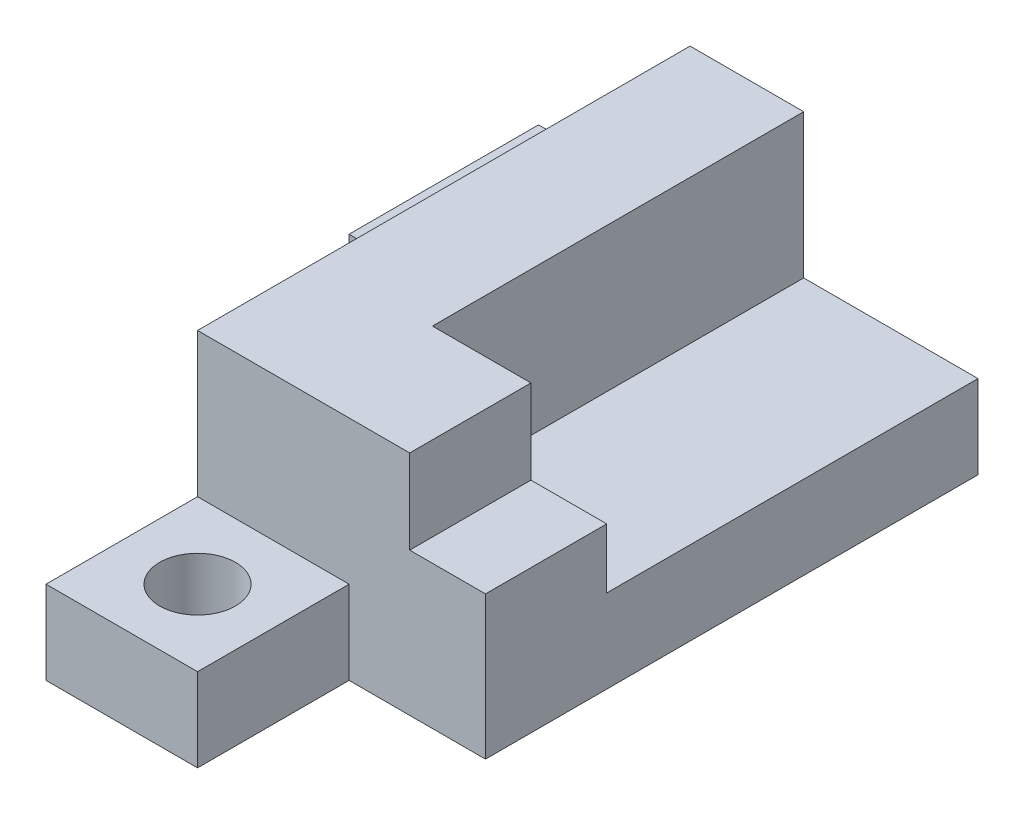
from build123d import *

# Parameters (mm, degrees)
SKETCH1_W                   = 369
SKETCH1_H                   = 200
BOSS_EXTRUDE1_DEPTH         = 20
SKETCH2_W                   = 129
SKETCH2_H                   = 16
BOSS_EXTRUDE2_DEPTH         = 10
SKETCH3_W                   = 342
SKETCH3_H                   = 168
CUT_EXTRUDE1_DEPTH          = 9
SKETCH4_W                   = 100
SKETCH4_H                   = 10
BOSS_EXTRUDE3_DEPTH         = 60
CUT_EXTRUDE3_DEPTH          = 10
CUT_EXTRUDE3_DEPTH_BACK     = 60
SKETCH10_W                  = 404
SKETCH10_H                  = 324.796202869
CUT_EXTRUDE4_DEPTH          = 69
CUT_EXTRUDE7_DEPTH          = 274.752168941
CUT_EXTRUDE7_DEPTH_BACK     = 274.752168941
SKETCH14_W                  = 37
SKETCH14_H                  = 34.717467541
SKETCH12_W                  = 50
SKETCH12_H                  = 11
BOSS_EXTRUDE6_DEPTH         = 20
SKETCH13_R                  = 4
CUT_EXTRUDE6_DEPTH          = 229.43215623
CORTAR_EXTRUIR4_DEPTH       = 220
CROQUIS5_W                  = 20
CROQUIS5_H                  = 11
SALIENTE_EXTRUIR2_DEPTH     = 10
CROQUIS6_W                  = 20
CROQUIS6_H                  = 11
SALIENTE_EXTRUIR3_DEPTH     = 20
CROQUIS8_R                  = 5
CORTAR_EXTRUIR5_DEPTH       = 48
CROQUIS9_W                  = 38
CROQUIS9_H                  = 65
CORTAR_EXTRUIR6_DEPTH       = 85
CROQUIS10_W                 = 10
CROQUIS10_H                 = 16
SALIENTE_EXTRUIR4_DEPTH     = 7.89
CROQUIS11_W                 = 16
CROQUIS11_H                 = 19
SALIENTE_EXTRUIR5_DEPTH     = 13
CORTAR_EXTRUIR10_DEPTH      = 36.9
CORTAR_EXTRUIR10_DEPTH_BACK = 7.894953
CROQUIS12_W                 = 18
CROQUIS12_H                 = 16
CROQUIS13_W                 = 5
CROQUIS13_H                 = 16
CORTAR_EXTRUIR11_DEPTH      = 19
CROQUIS14_W                 = 25
CROQUIS14_H                 = 11
SALIENTE_EXTRUIR6_DEPTH     = 20
CROQUIS15_W                 = 20
CROQUIS15_H                 = 25
CORTAR_EXTRUIR12_DEPTH      = 238.868135739
CROQUIS16_R                 = 5
CORTAR_EXTRUIR13_DEPTH      = 238.868135739
CROQUIS17_W                 = 20
CROQUIS17_H                 = 20
SALIENTE_EXTRUIR7_DEPTH     = 11
CROQUIS18_W                 = 20
CROQUIS18_H                 = 20
CORTAR_EXTRUIR14_DEPTH      = 238.868135739
CROQUIS19_R                 = 5
CORTAR_EXTRUIR15_DEPTH      = 229.43215623


with BuildPart() as part:
    # Sketch1 → Boss-Extrude1 (new body)
    with BuildSketch(Plane(origin=(0, 0, 0), x_dir=(1, 0, 0), z_dir=(0, 1, 0))):
        Rectangle(SKETCH1_W, SKETCH1_H)
    extrude(amount=BOSS_EXTRUDE1_DEPTH)

    # Sketch2 → Boss-Extrude2 (add)
    with BuildSketch(Plane(origin=(0, 20, 0), x_dir=(1, 0, 0), z_dir=(0, 1, 0))):
        Polygon((-184.5, -100), (-169.5, -100), (-119.5, -100), (-119.5, -84), (-169.5, -84), (-169.5, -35), (-184.5, -35), align=None)
        Polygon((-184.5, 100), (-169.5, 100), (-119.5, 100), (-119.5, 84), (-169.5, 84), (-169.5, 35), (-184.5, 35), align=None)
        with Locations((20, -92)):
            Rectangle(SKETCH2_W, SKETCH2_H)
        with Locations((20, 92)):
            Rectangle(SKETCH2_W, SKETCH2_H)
    extrude(amount=BOSS_EXTRUDE2_DEPTH)

    # Sketch3 → Cut-Extrude1 (cut)
    with BuildSketch(Plane(origin=(0, 20, 0), x_dir=(1, 0, 0), z_dir=(0, 1, 0))):
        with Locations((1.5, 0)):
            Rectangle(SKETCH3_W, SKETCH3_H)
    extrude(amount=-CUT_EXTRUDE1_DEPTH, mode=Mode.SUBTRACT)

    # Sketch4 → Boss-Extrude3 (add)
    with BuildSketch(Plane(origin=(0, 0, -100), x_dir=(-1, 0, 0), z_dir=(0, 0, -1))):
        with Locations((-19.5, 25)):
            Rectangle(SKETCH4_W, SKETCH4_H)
    extrude(amount=BOSS_EXTRUDE3_DEPTH)

    # Sketch6 → Cut-Extrude3 (cut, two sides: drawn at the far end of the back side and taken through both)
    with BuildSketch(Plane.XY.offset(-84).offset(-CUT_EXTRUDE3_DEPTH_BACK)):
        with BuildLine():
            Line((-24.5, 30), (-26.030765637, 28.081051534))
            ThreePointArc((-26.030765637, 28.081051534), (-26.158442873, 26.948989892), (-25.193843525, 26.342843758))
            Line((-25.193843525, 26.342843758), (-15.806155854, 26.342843758))
            ThreePointArc((-15.806155854, 26.342843758), (-14.841556992, 26.948990172), (-14.969234363, 28.081051534))
            Line((-14.969234363, 28.081051534), (-16.5, 30))
            Line((-16.5, 30), (-24.5, 30))
        make_face()
        with BuildLine():
            Line((56.5, 30), (54.981983491, 27.801494438))
            ThreePointArc((54.981983491, 27.801494438), (54.9192914, 26.767046688), (55.80615587, 26.230871478))
            Line((55.80615587, 26.230871478), (65.193843541, 26.230871478))
            ThreePointArc((65.193843541, 26.230871478), (66.080708464, 26.767046428), (66.018016509, 27.801494438))
            Line((66.018016509, 27.801494438), (64.5, 30))
            Line((64.5, 30), (56.5, 30))
        make_face()
    extrude(amount=CUT_EXTRUDE3_DEPTH + CUT_EXTRUDE3_DEPTH_BACK, mode=Mode.SUBTRACT)

    # Sketch10 → Cut-Extrude4 (cut)
    with BuildSketch(Plane(origin=(0, 30, 0), x_dir=(1, 0, 0), z_dir=(0, 1, 0))):
        with Locations((55.5, -0.89352463)):
            Rectangle(SKETCH10_W, SKETCH10_H)
    extrude(amount=-CUT_EXTRUDE4_DEPTH, mode=Mode.SUBTRACT)

    # Sketch14 → Cut-Extrude7 (cut, two sides: drawn at the far end of the back side and taken through both)
    with BuildSketch(Plane(origin=(0, 0, -100), x_dir=(-1, 0, 0), z_dir=(0, 0, -1)).offset(-CUT_EXTRUDE7_DEPTH_BACK)):
        with Locations((138, 36.253686327)):
            Rectangle(SKETCH14_W, SKETCH14_H)
    extrude(amount=CUT_EXTRUDE7_DEPTH + CUT_EXTRUDE7_DEPTH_BACK, mode=Mode.SUBTRACT)

    # Sketch12 → Boss-Extrude6 (add)
    with BuildSketch(Plane.ZY.offset(184.5)):
        with Locations((-25, 5.5)):
            Rectangle(SKETCH12_W, SKETCH12_H)
    extrude(amount=BOSS_EXTRUDE6_DEPTH)

    # Sketch13 → Cut-Extrude6 (cut, through all)
    with BuildSketch(Plane(origin=(0, 11, 0), x_dir=(1, 0, 0), z_dir=(0, 1, 0))):
        with Locations(Location((-194.5, 25, 0), (0, 0, 270))):
            Circle(SKETCH13_R)
    extrude(amount=-CUT_EXTRUDE6_DEPTH, mode=Mode.SUBTRACT)

    # Croquis3 → Cortar-Extruir4 (cut)
    with BuildSketch(Plane(origin=(0, 30, 0), x_dir=(1, 0, 0), z_dir=(0, 1, 0))):
        Polygon((-169.5, -35), (-146.5, -35), (-146.5, 0), (-146.5, 35), (-204.5, 35), (-204.5, 0), (-204.5, -35), (-184.5, -35), align=None)
    extrude(amount=-CORTAR_EXTRUIR4_DEPTH, mode=Mode.SUBTRACT)


with BuildPart() as cortar_extruir4_piece_1:
    # of the separate pieces the step leaves, piece 1, a body of its own (cortar_extruir4_pieces)
    add(part.part.solids().sort_by_distance((-184.5, 30, -100))[0])

    # Croquis5 → Saliente-Extruir2 (add)
    with BuildSketch(Plane(origin=(0, 0, -50), x_dir=(-1, 0, 0), z_dir=(0, 0, -1))):
        with Locations((194.5, 5.5)):
            Rectangle(CROQUIS5_W, CROQUIS5_H)
    extrude(amount=SALIENTE_EXTRUIR2_DEPTH)

    # Croquis6 → Saliente-Extruir3 (add)
    with BuildSketch(Plane(origin=(0, 0, -100), x_dir=(-1, 0, 0), z_dir=(0, 0, -1))):
        with Locations((174.5, 5.5)):
            Rectangle(CROQUIS6_W, CROQUIS6_H)
    extrude(amount=SALIENTE_EXTRUIR3_DEPTH)

    # Croquis8 → Cortar-Extruir5 (cut)
    with BuildSketch(Plane(origin=(0, 11, 0), x_dir=(1, 0, 0), z_dir=(0, 1, 0))):
        with Locations(Location((-194.5, 47.5, 0), (0, 0, 270))):
            Circle(CROQUIS8_R)
        with Locations((-194.5, -47.5)):
            Circle(CROQUIS8_R)
        with Locations((-174.5, -110)):
            Circle(CROQUIS8_R)
        with Locations(Location((-174.5, 110, 0), (0, 0, 270))):
            Circle(CROQUIS8_R)
    extrude(amount=-CORTAR_EXTRUIR5_DEPTH, mode=Mode.SUBTRACT)

    # Croquis10 → Saliente-Extruir4 (add)
    with BuildSketch(Plane(origin=(0, 11, 0), x_dir=(1, 0, 0), z_dir=(0, 1, 0))):
        with Locations((-151.5, 43)):
            Rectangle(CROQUIS10_W, CROQUIS10_H)
    extrude(amount=SALIENTE_EXTRUIR4_DEPTH)

    # Croquis11 → Saliente-Extruir5 (add)
    with BuildSketch(Plane(origin=(-169.5, 0, 0), x_dir=(0, 0, -1), z_dir=(1, 0, 0))):
        with Locations((43, 20.5)):
            Rectangle(CROQUIS11_W, CROQUIS11_H)
    extrude(amount=SALIENTE_EXTRUIR5_DEPTH)

    # Croquis12 → Cortar-Extruir10 (cut, two sides: drawn at the far end of the back side and taken through both)
    with BuildSketch(Plane(origin=(0, 18.894952557, 0), x_dir=(1, 0, 0), z_dir=(0, 1, 0)).offset(-CORTAR_EXTRUIR10_DEPTH_BACK)):
        with Locations((-155.5, 92)):
            Rectangle(CROQUIS12_W, CROQUIS12_H)
    extrude(amount=CORTAR_EXTRUIR10_DEPTH + CORTAR_EXTRUIR10_DEPTH_BACK, mode=Mode.SUBTRACT)

    # Croquis13 → Cortar-Extruir11 (cut)
    with BuildSketch(Plane(origin=(0, 30, 0), x_dir=(1, 0, 0), z_dir=(0, 1, 0))):
        with Locations((-167, 92)):
            Rectangle(CROQUIS13_W, CROQUIS13_H)
    extrude(amount=-CORTAR_EXTRUIR11_DEPTH, mode=Mode.SUBTRACT)

    # Croquis14 → Saliente-Extruir6 (add)
    with BuildSketch(Plane.ZY.offset(184.5)):
        with Locations((-87.5, 5.5)):
            Rectangle(CROQUIS14_W, CROQUIS14_H)
    extrude(amount=SALIENTE_EXTRUIR6_DEPTH)

    # Croquis15 → Cortar-Extruir12 (cut, through all)
    with BuildSketch(Plane(origin=(0, 11, 0), x_dir=(1, 0, 0), z_dir=(0, 1, 0))):
        with Locations((-194.5, 47.5)):
            Rectangle(CROQUIS15_W, CROQUIS15_H)
    extrude(amount=-CORTAR_EXTRUIR12_DEPTH, mode=Mode.SUBTRACT)

    # Croquis16 → Cortar-Extruir13 (cut, through all)
    with BuildSketch(Plane(origin=(0, 11, 0), x_dir=(1, 0, 0), z_dir=(0, 1, 0))):
        with Locations(Location((-194.5, 87.5, 0), (0, 0, 270))):
            Circle(CROQUIS16_R)
    extrude(amount=-CORTAR_EXTRUIR13_DEPTH, mode=Mode.SUBTRACT)

    # Croquis17 → Saliente-Extruir7 (add)
    with BuildSketch(Plane(origin=(0, 11, 0), x_dir=(1, 0, 0), z_dir=(0, 1, 0))):
        with Locations((-174.5, 25)):
            Rectangle(CROQUIS17_W, CROQUIS17_H)
    extrude(amount=-SALIENTE_EXTRUIR7_DEPTH)

    # Croquis18 → Cortar-Extruir14 (cut, through all)
    with BuildSketch(Plane(origin=(0, 11, 0), x_dir=(1, 0, 0), z_dir=(0, 1, 0))):
        with Locations((-174.5, 110)):
            Rectangle(CROQUIS18_W, CROQUIS18_H)
    extrude(amount=-CORTAR_EXTRUIR14_DEPTH, mode=Mode.SUBTRACT)

    # Croquis19 → Cortar-Extruir15 (cut, through all)
    with BuildSketch(Plane(origin=(0, 11, 0), x_dir=(1, 0, 0), z_dir=(0, 1, 0))):
        with Locations(Location((-174.5, 25, 0), (0, 0, 270))):
            Circle(CROQUIS19_R)
    extrude(amount=-CORTAR_EXTRUIR15_DEPTH, mode=Mode.SUBTRACT)


with BuildPart() as cortar_extruir4_piece_2:
    # of the separate pieces the step leaves, piece 2, a body of its own (cortar_extruir4_pieces)
    add(part.part.solids().sort_by_distance((-184.5, 30, 100))[0])

    # Croquis9 → Cortar-Extruir6 (cut)
    with BuildSketch(Plane(origin=(0, 30, 0), x_dir=(1, 0, 0), z_dir=(0, 1, 0))):
        with Locations((-165.5, -67.5)):
            Rectangle(CROQUIS9_W, CROQUIS9_H)
    extrude(amount=-CORTAR_EXTRUIR6_DEPTH, mode=Mode.SUBTRACT)


solid = cortar_extruir4_piece_1.part
